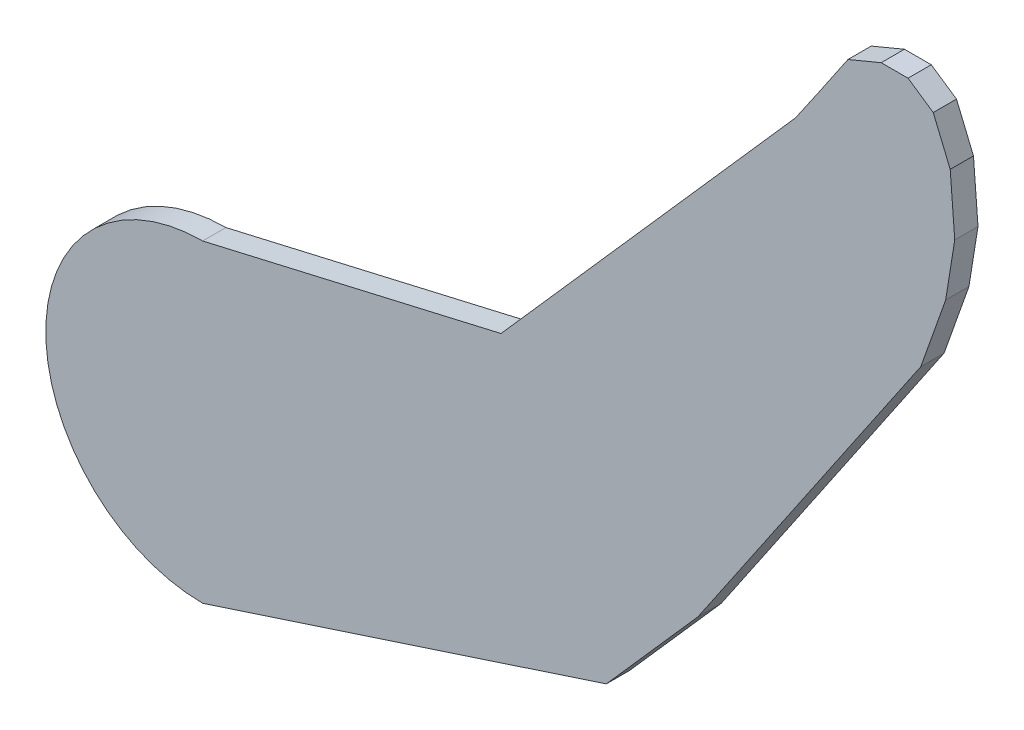
from build123d import *

# Parameters (mm, degrees)
SALIENTE_EXTRUIR1_DEPTH = 20


with BuildPart() as part:
    # Croquis1 → Saliente-Extruir1 (new body)
    with BuildSketch(Plane.XY):
        with BuildLine():
            Line((853.07011629, 88.169264479), (931.851074637, 177.517253669))
            Line((931.851074637, 177.517253669), (1123.432307328, 459.574764509))
            Line((1123.432307328, 459.574764509), (1144.834105581, 519.888923222))
            Line((1144.834105581, 519.888923222), (1152.616577673, 568.529373797))
            Line((1152.616577673, 568.529373797), (1148.725341627, 619.115442395))
            Line((1148.725341627, 619.115442395), (1134.133206454, 654.13656681))
            Line((1134.133206454, 654.13656681), (1112.467017385, 668.852839378))
            Line((1112.467017385, 668.852839378), (1089.383991925, 668.852839378))
            Line((1089.383991925, 668.852839378), (1060.811863494, 656.947785866))
            Line((1060.811863494, 656.947785866), (1035.115093442, 619.115442395))
            Line((1035.115093442, 619.115442395), (1015.768853134, 590.989004825))
            Line((1015.768853134, 590.989004825), (762.554169484, 303.810182778))
            Line((762.554169484, 303.810182778), (506.078323887, 244.468113377))
            ThreePointArc((506.078323887, 244.468113377), (371.222836086, 109.612625576), (506.078323887, -25.242862225))
            Line((506.078323887, -25.242862225), (853.07011629, 88.169264479))
        make_face()
    extrude(amount=SALIENTE_EXTRUIR1_DEPTH)


solid = part.part
